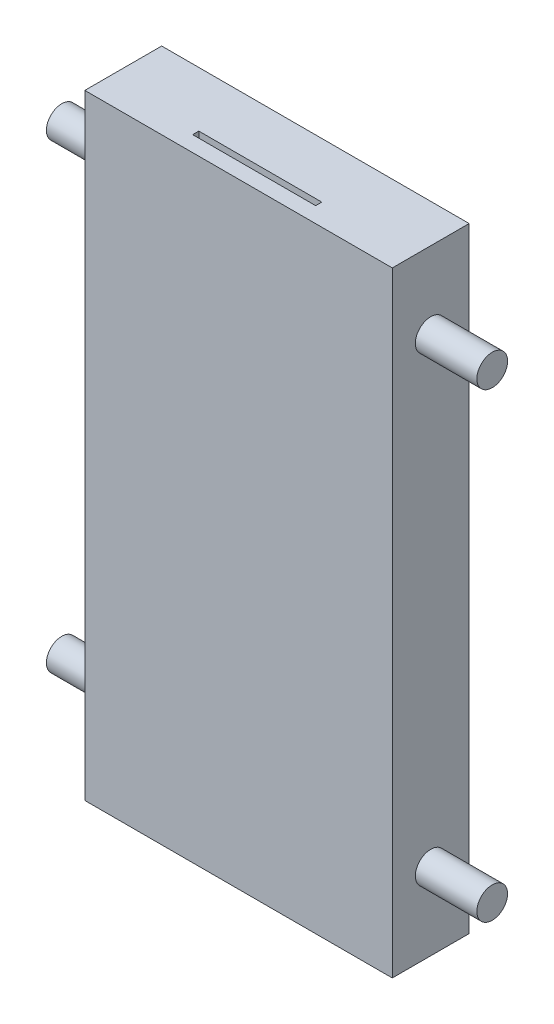
from build123d import *

# Parameters (mm, degrees)
SKETCH1_W                = 12.7
SKETCH1_H                = 25.4
BOSS_EXTRUDE1_DEPTH      = 3.175
BOSS_EXTRUDE3_DEPTH      = 2.54
BOSS_EXTRUDE3_DEPTH_BACK = 15.24
SKETCH2_R                = 0.635
BOSS_EXTRUDE5_DEPTH      = 2.54
BOSS_EXTRUDE5_DEPTH_BACK = 15.24
SKETCH6_R                = 0.635
SKETCH7_W                = 5.08
SKETCH7_H                = 0.254
CUT_EXTRUDE1_DEPTH       = 30.790908429


with BuildPart() as part:
    # Sketch1 → Boss-Extrude1 (new body)
    with BuildSketch(Plane.XY):
        with Locations((6.35, 12.7)):
            Rectangle(SKETCH1_W, SKETCH1_H)
    extrude(amount=BOSS_EXTRUDE1_DEPTH)

    # Sketch2 → Boss-Extrude3 (add, two sides: drawn at the far end of the back side and taken through both)
    with BuildSketch(Plane(origin=(12.7, 0, 0), x_dir=(0, 0, -1), z_dir=(1, 0, 0)).offset(-BOSS_EXTRUDE3_DEPTH_BACK)):
        with Locations((-1.5875, 22.225)):
            Circle(SKETCH2_R)
    extrude(amount=BOSS_EXTRUDE3_DEPTH + BOSS_EXTRUDE3_DEPTH_BACK)

    # Sketch6 → Boss-Extrude5 (add, two sides: drawn at the far end of the back side and taken through both)
    with BuildSketch(Plane(origin=(12.7, 0, 0), x_dir=(0, 0, -1), z_dir=(1, 0, 0)).offset(-BOSS_EXTRUDE5_DEPTH_BACK)):
        with Locations((-1.5875, 3.175)):
            Circle(SKETCH6_R)
    extrude(amount=BOSS_EXTRUDE5_DEPTH + BOSS_EXTRUDE5_DEPTH_BACK)

    # Sketch7 → Cut-Extrude1 (cut, through all)
    with BuildSketch(Plane(origin=(0, 25.4, 0), x_dir=(1, 0, 0), z_dir=(0, 1, 0))):
        with Locations((6.35, -2.403553661)):
            Rectangle(SKETCH7_W, SKETCH7_H)
    extrude(amount=-CUT_EXTRUDE1_DEPTH, mode=Mode.SUBTRACT)


solid = part.part
